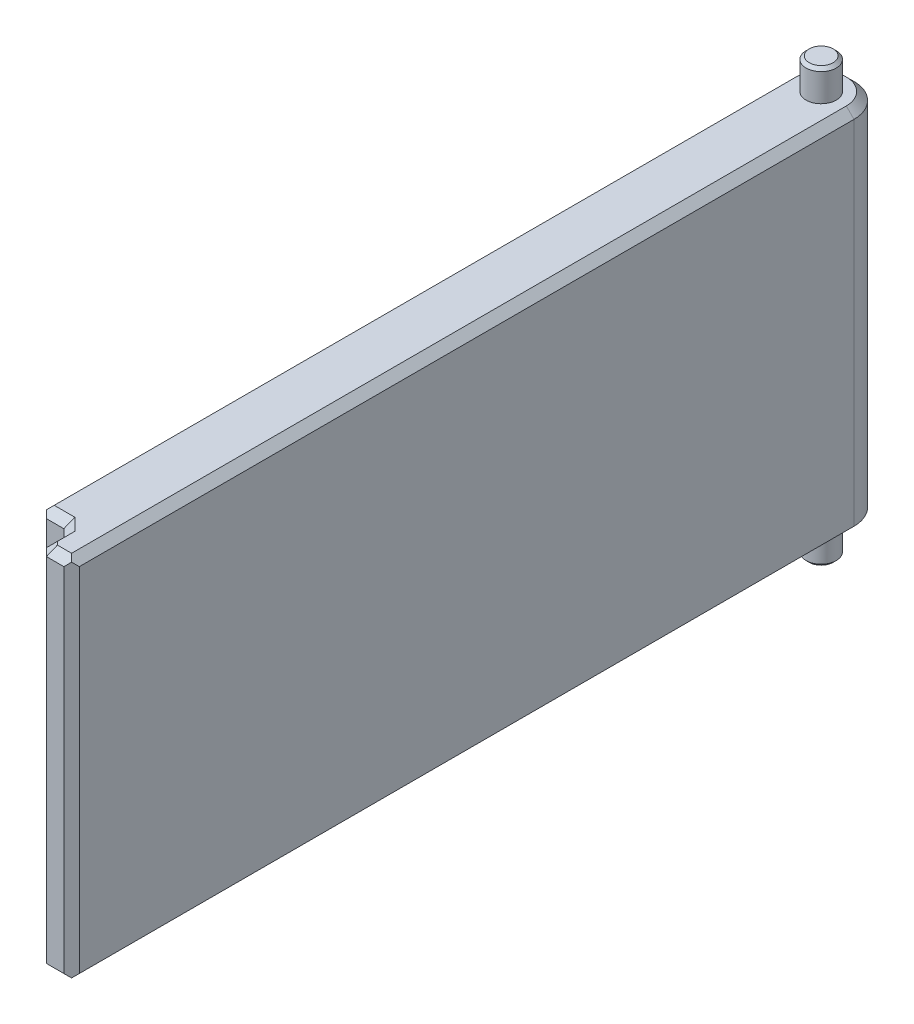
from build123d import *

# Parameters (mm, degrees)
SKETCH_2_R          = 0.975
EXTRUDE_1_DEPTH     = 28
EXTRUDE_2_DEPTH     = 23.8
SKETCH_5_R          = 0.975
EXTRUDE_3_DEPTH     = 2
CUT_EXTRUDE_START   = -2
SKETCH_7_R          = 2.125
CUT_EXTRUDE_1_DEPTH = 2
CHAMFER_1_SIZE      = 0.5
CHAMFER_2_SIZE      = 0.5
CHAMFER_3_SIZE      = 0.5
CHAMFER_4_SIZE      = 0.5
CHAMFER_7_SIZE      = 0.2


with BuildPart() as part:
    # 草图2 → 凸台-拉伸1 (new body)
    with BuildSketch(Plane(origin=(0, 0, 0), x_dir=(1, 0, 0), z_dir=(0, 1, 0))):
        with Locations(Location((0, 0, 0), (0, 0, 270))):
            Circle(SKETCH_2_R)
    extrude(amount=EXTRUDE_1_DEPTH)

    # 草图4 → 凸台-拉伸2 (add)
    with BuildSketch(Plane(origin=(0, 28, 0), x_dir=(1, 0, 0), z_dir=(0, 1, 0))):
        with BuildLine():
            Line((0, -48.5), (-2.125, -48.5))
            Line((-2.125, -48.5), (-2.125, 0))
            ThreePointArc((-2.125, 0), (0, 2.125), (2.125, 0))
            Line((2.125, 0), (2.125, -47.7))
            Line((2.125, -47.7), (2.125, -50.625))
            Line((2.125, -50.625), (0, -50.625))
            Line((0, -50.625), (0, -48.5))
        make_face()
    extrude(amount=-EXTRUDE_2_DEPTH)

    # 草图5 → 凸台-拉伸3 (add)
    with BuildSketch(Plane(origin=(0, 28, 0), x_dir=(1, 0, 0), z_dir=(0, 1, 0))):
        with Locations(Location((0, 0, 0), (0, 0, 270))):
            Circle(SKETCH_5_R)
    extrude(amount=EXTRUDE_3_DEPTH)

    # 草图7 → 切除-拉伸1 (cut)
    with BuildSketch(Plane.XZ.offset(CUT_EXTRUDE_START)):
        Circle(SKETCH_7_R)
    extrude(amount=CUT_EXTRUDE_1_DEPTH, mode=Mode.SUBTRACT)

    # 倒角1
    chamfer_1_edges = [part.edges().sort_by_distance(p)[0] for p in [
        (2.125, 28, 25.3125),
        (0, 28, -2.125),
        (-2.125, 28, 24.25),
        (-2.125, 4.2, 24.25),
        (0, 4.2, -2.125),
        (2.125, 4.2, 25.3125),
    ]]
    chamfer(chamfer_1_edges, length=CHAMFER_1_SIZE)

    # 倒角2
    chamfer_2_edges = [part.edges().sort_by_distance(p)[0] for p in [
        (-2.125, 16.1, 48.5),
        (2.125, 16.1, 50.625),
    ]]
    chamfer(chamfer_2_edges, length=CHAMFER_2_SIZE)

    # 倒角3
    chamfer_3_edges = [part.edges().sort_by_distance(p)[0] for p in [
        (0, 16.1, 50.625),
        (0, 16.1, 48.5),
    ]]
    chamfer(chamfer_3_edges, length=CHAMFER_3_SIZE)

    # 倒角4
    chamfer_4_edges = [part.edges().sort_by_distance(p)[0] for p in [
        (-1.0625, 28, 48.5),
        (-1.0625, 4.2, 48.5),
        (0, 28, 49.5625),
        (0, 4.2, 49.5625),
        (1.0625, 28, 50.625),
        (0.25, 28, 50.375),
        (1.0625, 4.2, 50.625),
        (0.25, 4.2, 50.375),
        (-0.25, 28, 48.75),
        (-0.25, 4.2, 48.75),
    ]]
    chamfer(chamfer_4_edges, length=CHAMFER_4_SIZE)

    # 倒角7
    chamfer_7_edges = [part.edges().sort_by_distance(p)[0] for p in [
        (0, 30, -0.975),
        (0, 2, -0.975),
    ]]
    chamfer(chamfer_7_edges, length=CHAMFER_7_SIZE)


solid = part.part
